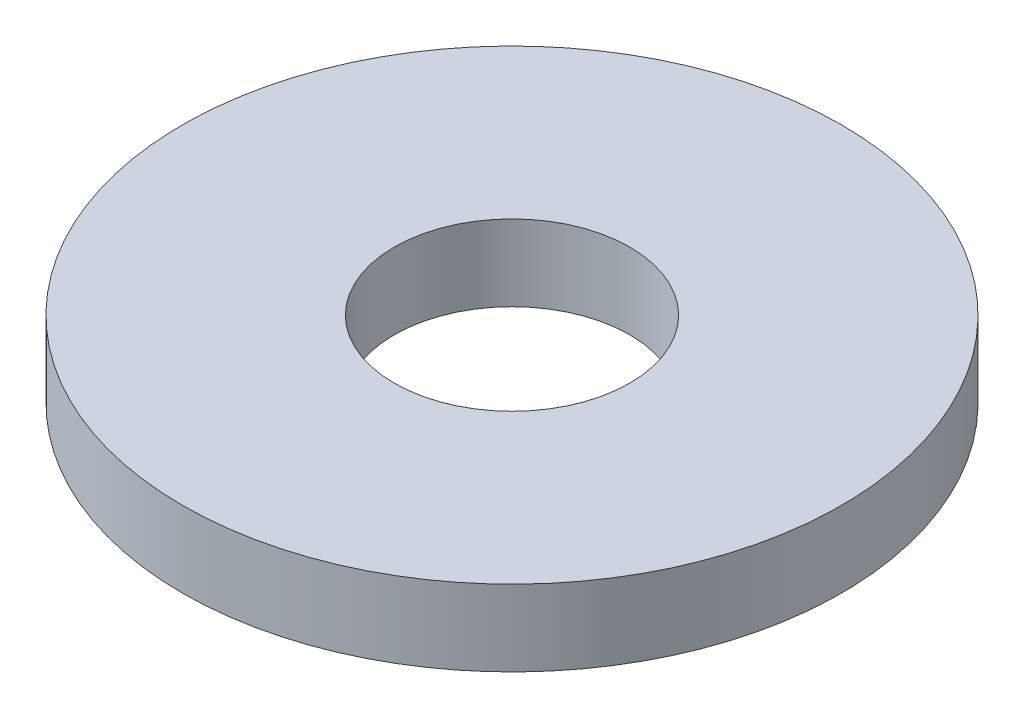
from build123d import *

# Parameters (mm, degrees)
SKETCH1_R           = 11.0109
SKETCH1_R_2         = 3.937
BOSS_EXTRUDE1_DEPTH = 2.54


with BuildPart() as part:
    # Sketch1 → Boss-Extrude1 (new body)
    with BuildSketch(Plane(origin=(0, 0, 0), x_dir=(1, 0, 0), z_dir=(0, 1, 0))):
        with Locations(Location((0, 0, 0), (0, 0, 270))):
            Circle(SKETCH1_R)
        with Locations(Location((0, 0, 0), (0, 0, 270))):
            Circle(SKETCH1_R_2, mode=Mode.SUBTRACT)
    extrude(amount=BOSS_EXTRUDE1_DEPTH)


solid = part.part
